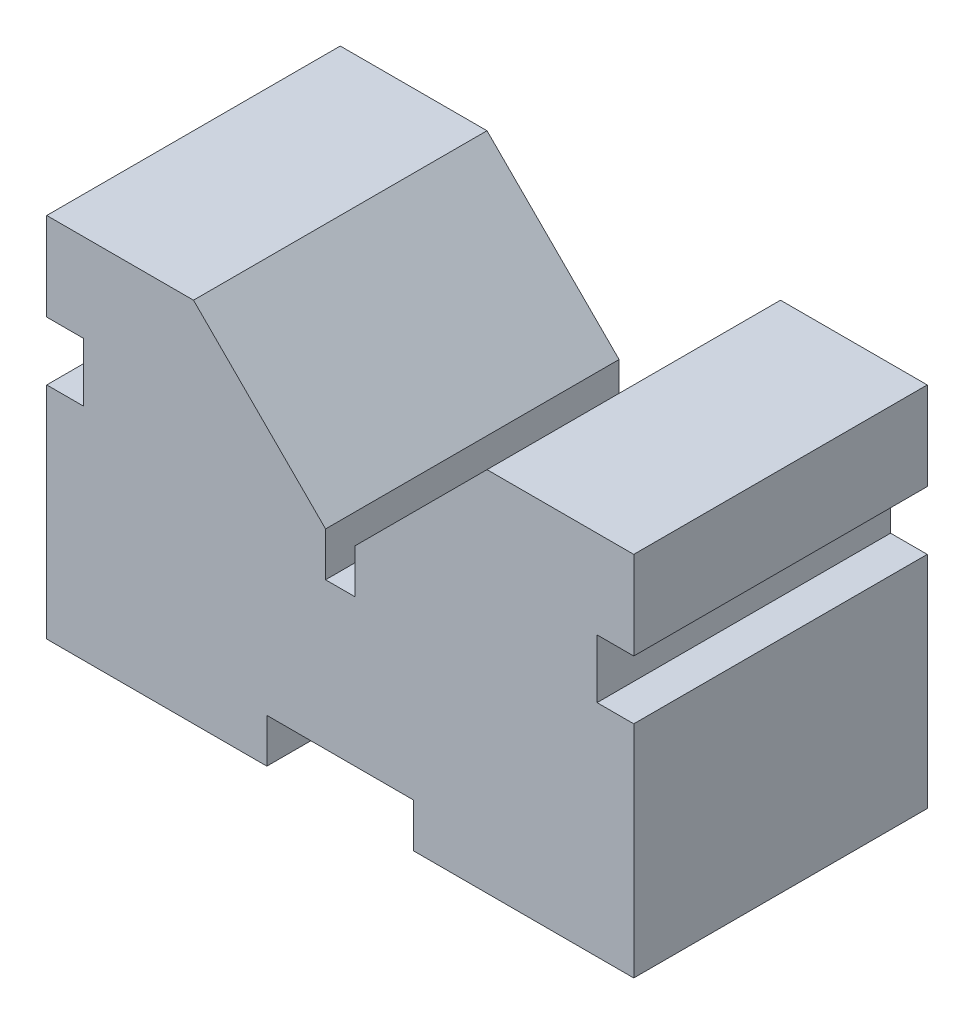
from build123d import *

# Parameters (mm, degrees)
SKETCH_1_W          = 80
SKETCH_1_H          = 40
EXTRUDE_1_DEPTH     = 50
CUT_EXTRUDE_1_DEPTH = 81
SKETCH_3_W          = 20
SKETCH_3_H          = 6
CUT_EXTRUDE_2_DEPTH = 81
SKETCH_4_W          = 5
SKETCH_4_H          = 8
CUT_EXTRUDE_3_DEPTH = 81


with BuildPart() as part:
    # 草图1 → 凸台-拉伸1 (new body)
    with BuildSketch(Plane(origin=(0, 0, 0), x_dir=(1, 0, 0), z_dir=(0, 1, 0))):
        Rectangle(SKETCH_1_W, SKETCH_1_H)
    extrude(amount=EXTRUDE_1_DEPTH)

    # 草图2 → 切除-拉伸1 (cut, symmetric)
    with BuildSketch(Plane.XY):
        Polygon((-20, 50), (20, 50), (2, 32), (2, 26), (-2, 26), (-2, 32), align=None)
    extrude(amount=CUT_EXTRUDE_1_DEPTH, both=True, mode=Mode.SUBTRACT)

    # 草图3 → 切除-拉伸2 (cut, symmetric)
    with BuildSketch(Plane.XY):
        with Locations((0, 3)):
            Rectangle(SKETCH_3_W, SKETCH_3_H)
    extrude(amount=CUT_EXTRUDE_2_DEPTH, both=True, mode=Mode.SUBTRACT)

    # 草图4 → 切除-拉伸3 (cut, symmetric)
    with BuildSketch(Plane.XY):
        with Locations((-37.5, 34)):
            Rectangle(SKETCH_4_W, SKETCH_4_H)
        with Locations((37.5, 34)):
            Rectangle(SKETCH_4_W, SKETCH_4_H)
    extrude(amount=CUT_EXTRUDE_3_DEPTH, both=True, mode=Mode.SUBTRACT)


solid = part.part
